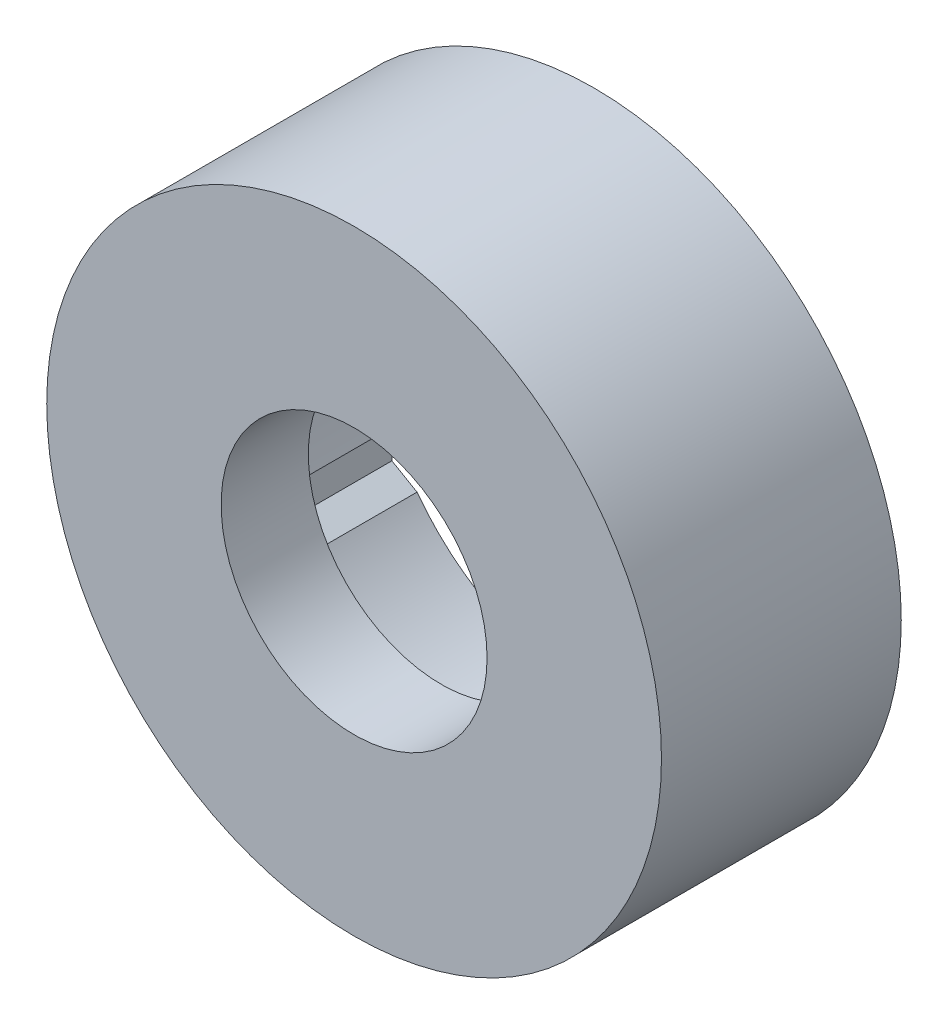
from build123d import *

# Parameters (mm, degrees)
SKETCH1_R           = 7.05
SKETCH1_R_2         = 5.05
SKETCH1_R_3         = 3.05
BOSS_EXTRUDE1_DEPTH = 2
BOSS_EXTRUDE2_START = -3.5
SKETCH1_3_R         = 7.05
SKETCH1_3_R_2       = 5.05
BOSS_EXTRUDE2_DEPTH = 3.5
CUT_EXTRUDE1_DEPTH  = 3.5


with BuildPart() as part:
    # Sketch1 → Boss-Extrude1 (new body)
    # profile 1 of 2: a face of its own
    with BuildSketch(Plane.XY):
        Circle(SKETCH1_R)
        Circle(SKETCH1_R_2, mode=Mode.SUBTRACT)
    # profile 2 of 2: a face of its own
    with BuildSketch(Plane.XY):
        Circle(SKETCH1_R_2)
        Circle(SKETCH1_R_3, mode=Mode.SUBTRACT)
    extrude(amount=BOSS_EXTRUDE1_DEPTH)

    # Sketch1<3> → Boss-Extrude2 (add)
    with BuildSketch(Plane.XY.offset(BOSS_EXTRUDE2_START)):
        Circle(SKETCH1_3_R)
        Circle(SKETCH1_3_R_2, mode=Mode.SUBTRACT)
    extrude(amount=BOSS_EXTRUDE2_DEPTH)

    # Sketch2 → Cut-Extrude1 (cut)
    with BuildSketch(Plane(origin=(0, 0, -3.5), x_dir=(-1, 0, 0), z_dir=(0, 0, -1))):
        with BuildLine():
            Line((0.576871206, 5.016943254), (0, 5.35))
            Line((0, 5.35), (-0.576871206, 5.016943254))
            ThreePointArc((-0.576871206, 5.016943254), (0, 5.05), (0.576871206, 5.016943254))
        make_face()
        with BuildLine():
            Line((4.63323591, 2.675), (4.056364704, 3.008056746))
            ThreePointArc((4.056364704, 3.008056746), (4.373428289, 2.525), (4.63323591, 2.008886507))
            Line((4.63323591, 2.008886507), (4.63323591, 2.675))
        make_face()
        with BuildLine():
            ThreePointArc((-4.63323591, 2.008886507), (-4.373428289, 2.525), (-4.056364704, 3.008056746))
            Line((-4.056364704, 3.008056746), (-4.63323591, 2.675))
            Line((-4.63323591, 2.675), (-4.63323591, 2.008886507))
        make_face()
        with BuildLine():
            ThreePointArc((-4.056364704, -3.008056746), (-4.373428289, -2.525), (-4.63323591, -2.008886507))
            Line((-4.63323591, -2.008886507), (-4.63323591, -2.675))
            Line((-4.63323591, -2.675), (-4.056364704, -3.008056746))
        make_face()
        with BuildLine():
            ThreePointArc((0.576871206, -5.016943254), (0, -5.05), (-0.576871206, -5.016943254))
            Line((-0.576871206, -5.016943254), (0, -5.35))
            Line((0, -5.35), (0.576871206, -5.016943254))
        make_face()
        with BuildLine():
            Line((4.63323591, -2.675), (4.63323591, -2.008886507))
            ThreePointArc((4.63323591, -2.008886507), (4.373428289, -2.525), (4.056364704, -3.008056746))
            Line((4.056364704, -3.008056746), (4.63323591, -2.675))
        make_face()
    extrude(amount=-CUT_EXTRUDE1_DEPTH, mode=Mode.SUBTRACT)


solid = part.part
